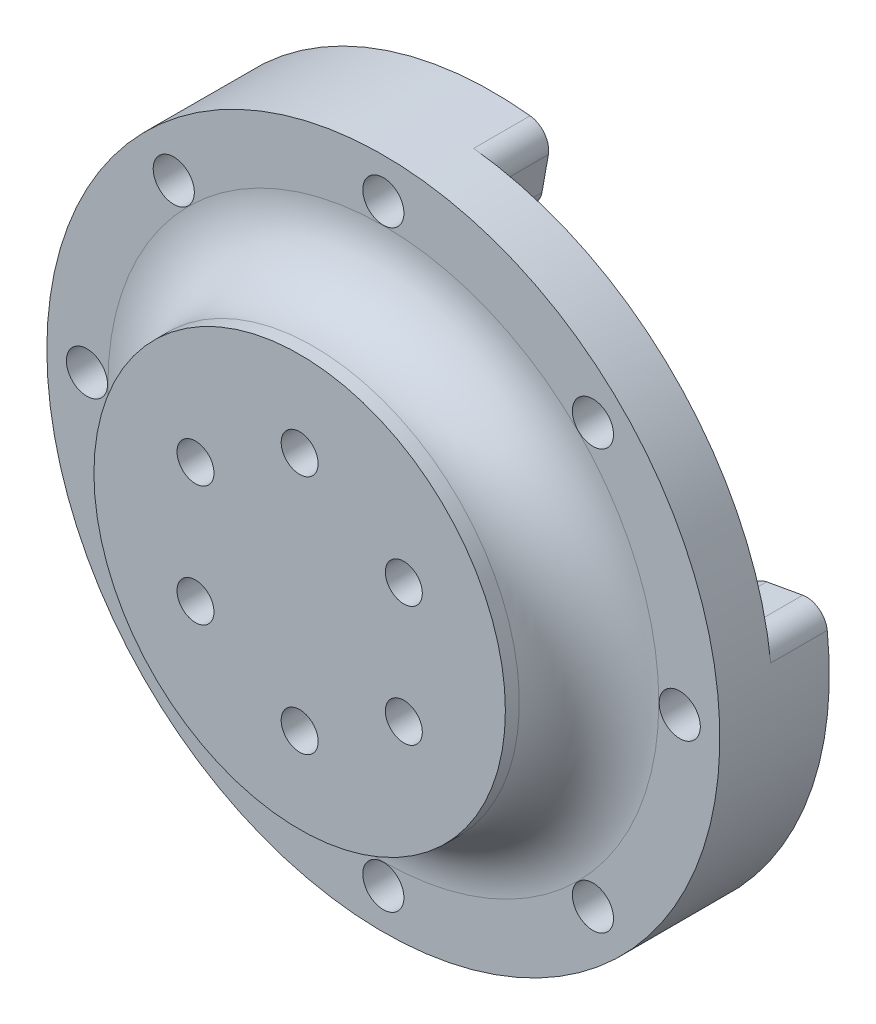
from build123d import *
from build123d.topology import SkipClean

# Parameters (mm, degrees)
SKETCH_1_R                     = 29.5
SKETCH_1_R_2                   = 1.65
EXTRUDE_1_DEPTH                = 12
SKETCH_3_R                     = 48.25
SKETCH_3_R_2                   = 27
SKETCH_3_R_3                   = 1.8
EXTRUDE_2_DEPTH                = 7.6
EXTRUDE_START                  = 7.6
SKETCH_4_R                     = 31.688827667
SKETCH_4_R_2                   = 1.65
EXTRUDE_3_DEPTH                = 7.6
HOLE_WIZARD_M4_5_1_D           = 5.3
HOLE_WIZARD_M4_5_1_DEPTH       = 100
HOLE_WIZARD_M4_5_1_CSINK_D     = 10.1
HOLE_WIZARD_M4_5_1_CSINK_ANGLE = 90
HOLE_WIZARD_M4_5_1_TIP         = 1.59228064
SKETCH_7_R                     = 1.8
EXTRUDE_4_DEPTH                = 8.1
SKETCH_10_R                    = 1.8
CUT_EXTRUDE_1_DEPTH            = 82
FILLET_1_R                     = 10
PATTERN_CIRCULAR_1_COUNT       = 8


with BuildPart() as part:
    # 草图1 → 凸台-拉伸1 (new body)
    with BuildSketch(Plane.XY):
        Circle(SKETCH_1_R)
        with Locations((0, 17.25)):
            Circle(SKETCH_1_R_2, mode=Mode.SUBTRACT)
        with Locations((14.938938215, 8.625)):
            Circle(SKETCH_1_R_2, mode=Mode.SUBTRACT)
        with Locations((14.938938215, -8.625)):
            Circle(SKETCH_1_R_2, mode=Mode.SUBTRACT)
        with Locations((0, -17.25)):
            Circle(SKETCH_1_R_2, mode=Mode.SUBTRACT)
        with Locations((-14.938938215, -8.625)):
            Circle(SKETCH_1_R_2, mode=Mode.SUBTRACT)
        with Locations((-14.938938215, 8.625)):
            Circle(SKETCH_1_R_2, mode=Mode.SUBTRACT)
    extrude(amount=EXTRUDE_1_DEPTH)



with BuildPart() as body_2:
    # 草图3 → 凸台-拉伸2 (new body)
    with BuildSketch(Plane(origin=(0, 0, 0), x_dir=(-1, 0, 0), z_dir=(0, 0, -1))):
        with Locations(Location((0, 0, 0), (0, 0, 180))):
            Circle(SKETCH_3_R)
        with Locations(Location((0, 0, 0), (0, 0, 180))):
            Circle(SKETCH_3_R_2, mode=Mode.SUBTRACT)
        with Locations(Location((30.0520382, 30.0520382, 0), (0, 0, 180))):
            Circle(SKETCH_3_R_3, mode=Mode.SUBTRACT)
        with Locations(Location((42.5, 0, 0), (0, 0, 180))):
            Circle(SKETCH_3_R_3, mode=Mode.SUBTRACT)
        with Locations(Location((30.0520382, -30.0520382, 0), (0, 0, 180))):
            Circle(SKETCH_3_R_3, mode=Mode.SUBTRACT)
        with Locations(Location((0, -42.5, 0), (0, 0, 180))):
            Circle(SKETCH_3_R_3, mode=Mode.SUBTRACT)
        with Locations(Location((0, 42.5, 0), (0, 0, 180))):
            Circle(SKETCH_3_R_3, mode=Mode.SUBTRACT)
        with Locations(Location((-30.0520382, -30.0520382, 0), (0, 0, 180))):
            Circle(SKETCH_3_R_3, mode=Mode.SUBTRACT)
        with Locations(Location((-42.5, 0, 0), (0, 0, 180))):
            Circle(SKETCH_3_R_3, mode=Mode.SUBTRACT)
        with Locations(Location((-30.0520382, 30.0520382, 0), (0, 0, 180))):
            Circle(SKETCH_3_R_3, mode=Mode.SUBTRACT)
    extrude(amount=EXTRUDE_2_DEPTH)


with BuildPart() as part_1:
    with SkipClean():  # the faces are left unmerged after this step: merging them gives an invalid solid
        add(part.part)

        add(body_2.part)  # 凸台-拉伸3 merges body 2
        # 草图4 → 凸台-拉伸3 (add)
        with BuildSketch(Plane(origin=(0, 0, 0), x_dir=(-1, 0, 0), z_dir=(0, 0, -1)).offset(EXTRUDE_START)):
            Circle(SKETCH_4_R)
            with Locations((0, 17.25)):
                Circle(SKETCH_4_R_2, mode=Mode.SUBTRACT)
            with Locations((14.938938215, 8.625)):
                Circle(SKETCH_4_R_2, mode=Mode.SUBTRACT)
            with Locations((14.938938215, -8.625)):
                Circle(SKETCH_4_R_2, mode=Mode.SUBTRACT)
            with Locations((0, -17.25)):
                Circle(SKETCH_4_R_2, mode=Mode.SUBTRACT)
            with Locations((-14.938938215, -8.625)):
                Circle(SKETCH_4_R_2, mode=Mode.SUBTRACT)
            with Locations((-14.938938215, 8.625)):
                Circle(SKETCH_4_R_2, mode=Mode.SUBTRACT)
        extrude(amount=-EXTRUDE_3_DEPTH)

    # M4.5 开槽半沉头木螺钉的锥形沉头孔1
    with Locations(Plane(origin=(0, 0, -7.6), x_dir=(-1, 0, 0), z_dir=(0, 0, -1))):
        with Locations((0, 17.25), (-14.938938215, 8.625), (-14.938938215, -8.625), (0, -17.25), (14.938938215, -8.625), (14.938938215, 8.625)):
            CounterSinkHole(HOLE_WIZARD_M4_5_1_D / 2, HOLE_WIZARD_M4_5_1_CSINK_D / 2, depth=HOLE_WIZARD_M4_5_1_DEPTH, counter_sink_angle=HOLE_WIZARD_M4_5_1_CSINK_ANGLE)
            with Locations((0, 0, -(HOLE_WIZARD_M4_5_1_DEPTH + HOLE_WIZARD_M4_5_1_TIP / 2))):  # 118° drill point
                Cone(0, HOLE_WIZARD_M4_5_1_D / 2, HOLE_WIZARD_M4_5_1_TIP, mode=Mode.SUBTRACT)

    # 草图7 → 凸台-拉伸4 (add)
    # profile 1 of 2: a face of its own
    with BuildSketch(Plane(origin=(0, 0, -7.6), x_dir=(-1, 0, 0), z_dir=(0, 0, -1))):
        with BuildLine():
            Line((-7.967725229, 44.441848011), (-7.038942591, 39.261345968))
            ThreePointArc((-7.038942591, 39.261345968), (-5.890899598, 37.39442154), (-3.779572987, 36.806450902))
            ThreePointArc((-3.779572987, 36.806450902), (26.165208609, 26.160693004), (36.805798017, -3.785925554))
            ThreePointArc((36.805798017, -3.785925554), (37.396744327, -5.901781323), (39.271052148, -7.047658005))
            Line((39.271052148, -7.047658005), (44.45355392, -7.957956022))
            ThreePointArc((44.45355392, -7.957956022), (46.771503658, -7.403977667), (47.954159452, -5.334893745))
            ThreePointArc((47.954159452, -5.334893745), (34.113495301, 34.122308515), (-5.347280913, 47.952779761))
            ThreePointArc((-5.347280913, 47.952779761), (-7.418993258, 46.765665189), (-7.967725229, 44.441848011))
        make_face()
        with Locations(Location((42.5, 0, 0), (0, 0, 180))):
            Circle(SKETCH_7_R, mode=Mode.SUBTRACT)
        with Locations(Location((0, 42.5, 0), (0, 0, 180))):
            Circle(SKETCH_7_R, mode=Mode.SUBTRACT)
        with Locations(Location((30.0520382, 30.0520382, 0), (0, 0, 180))):
            Circle(SKETCH_7_R, mode=Mode.SUBTRACT)
    # profile 2 of 2: a face of its own
    with BuildSketch(Plane(origin=(0, 0, -7.6), x_dir=(-1, 0, 0), z_dir=(0, 0, -1))):
        with BuildLine():
            Line((7.957956022, -44.45355392), (7.047658005, -39.271052148))
            ThreePointArc((7.047658005, -39.271052148), (5.901781323, -37.396744327), (3.785925554, -36.805798017))
            ThreePointArc((3.785925554, -36.805798017), (-26.160693004, -26.165208609), (-36.806450902, 3.779572987))
            ThreePointArc((-36.806450902, 3.779572987), (-37.39442154, 5.890899598), (-39.261345968, 7.038942591))
            Line((-39.261345968, 7.038942591), (-44.441848011, 7.967725229))
            ThreePointArc((-44.441848011, 7.967725229), (-46.765665189, 7.418993258), (-47.952779761, 5.347280913))
            ThreePointArc((-47.952779761, 5.347280913), (-34.122308515, -34.113495301), (5.334893745, -47.954159452))
            ThreePointArc((5.334893745, -47.954159452), (7.403977667, -46.771503658), (7.957956022, -44.45355392))
        make_face()
    extrude(amount=EXTRUDE_4_DEPTH)

    # 草图8 → 切除-旋转1 (revolve, cut)
    with BuildSketch(Plane(origin=(-20.476470588, -21.235916562, 0), x_dir=(0, 0, 1), z_dir=(-0.6941176470588265, -0.7198615783895669, 0)), mode=Mode.PRIVATE) as cut_revolve_1_sk:
        Polygon((-7.7, 30.594117082), (0, 30.594117082), (0, 32.394117082), (0, 33.544117082), (-7.7, 33.544117082), align=None)
    cut_revolve_1 = revolve(cut_revolve_1_sk.sketch.rotate(Axis((-42.5, 0, 0), (0, 0, -1)), 136.043053276), axis=Axis((-42.5, 0, 0), (0, 0, -1)), mode=Mode.SUBTRACT)

    # 草图10 → 切除-拉伸1 (cut)
    with BuildSketch(Plane.XY):
        with Locations((-30.0520382, 30.0520382)):
            Circle(SKETCH_10_R)
        with Locations((42.5, 0)):
            Circle(SKETCH_10_R)
        with Locations((30.0520382, -30.0520382)):
            Circle(SKETCH_10_R)
        with Locations((0, -42.5)):
            Circle(SKETCH_10_R)
        with Locations((30.0520382, 30.0520382)):
            Circle(SKETCH_10_R)
        with Locations((0, 42.5)):
            Circle(SKETCH_10_R)
    extrude(amount=-CUT_EXTRUDE_1_DEPTH, mode=Mode.SUBTRACT)

    # 圆角1
    fillet_1_edges = [part_1.edges().sort_by_distance(p)[0] for p in [
        (-29.5, 0, 0),
    ]]
    fillet(fillet_1_edges, radius=FILLET_1_R)

    # 阵列(圆周)1: 切除-旋转1 ×8 about axis
    pattern_circular_1_axis = Axis((0, 0, 0), (0, 0, 1))
    for i in range(1, PATTERN_CIRCULAR_1_COUNT):
        add(cut_revolve_1.rotate(pattern_circular_1_axis, i * 360 / PATTERN_CIRCULAR_1_COUNT), mode=Mode.SUBTRACT)


solid = part_1.part
